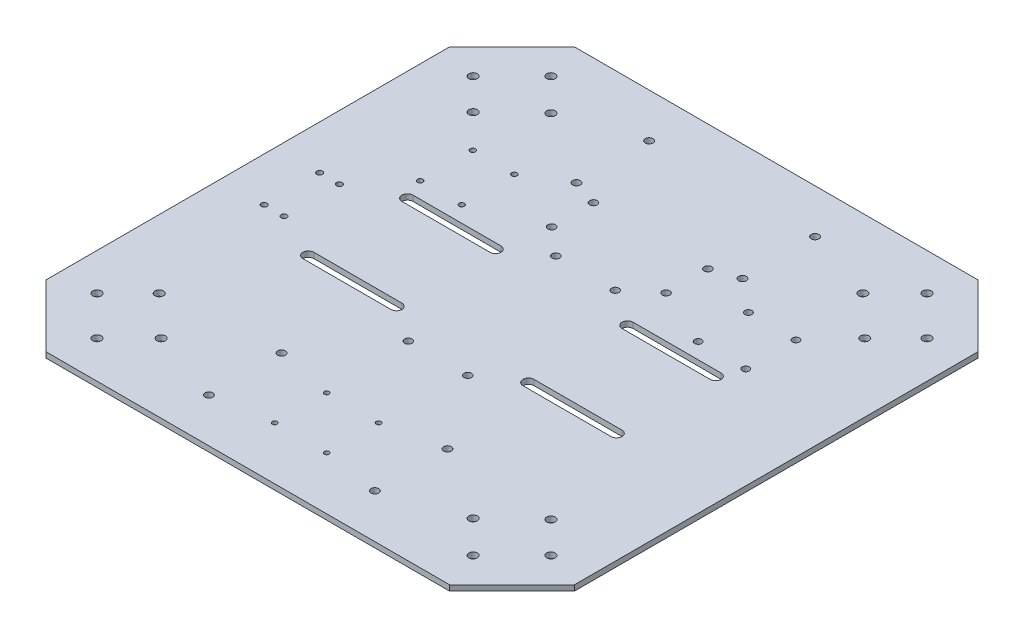
from build123d import *

# Parameters (mm, degrees)
BOSS_EXTRUDE1_DEPTH = 3.175
SKETCH2_R           = 2.4638
CUT_EXTRUDE1_DEPTH  = 6.35
SKETCH3_R           = 2.159
CUT_EXTRUDE2_DEPTH  = 6.35
SKETCH4_R           = 2.2225
CUT_EXTRUDE3_DEPTH  = 351.937720963
SKETCH5_R           = 1.651
CUT_EXTRUDE4_DEPTH  = 351.937720963
SKETCH6_R           = 2.032
SKETCH6_R_2         = 2.159
SKETCH6_R_3         = 1.397
SKETCH6_R_4         = 1.5499969
CUT_EXTRUDE5_DEPTH  = 351.937720963


with BuildPart() as part:
    # Sketch1 → Boss-Extrude1 (new body)
    with BuildSketch(Plane(origin=(0, 0, 0), x_dir=(1, 0, 0), z_dir=(0, 1, 0))):
        Polygon((-25.845025354, 51.656360067), (-61.766049839, 15.735335583), (-61.766049839, -217.222615449), (-25.845025354, -253.143639933), (207.112925677, -253.143639933), (243.033950161, -217.222615449), (243.033950161, 15.735335583), (207.112925677, 51.656360067), align=None)
        with BuildLine():
            ThreePointArc((52.533950161, -126.143639933), (55.708950161, -129.318639933), (52.533950161, -132.493639933))
            Line((52.533950161, -132.493639933), (1.733950161, -132.493639933))
            ThreePointArc((1.733950161, -132.493639933), (-1.441049839, -129.318639933), (1.733950161, -126.143639933))
            Line((1.733950161, -126.143639933), (52.533950161, -126.143639933))
        make_face(mode=Mode.SUBTRACT)
        with BuildLine():
            Line((179.533950161, -132.493639933), (128.733950161, -132.493639933))
            ThreePointArc((128.733950161, -132.493639933), (125.558950161, -129.318639933), (128.733950161, -126.143639933))
            Line((128.733950161, -126.143639933), (179.533950161, -126.143639933))
            ThreePointArc((179.533950161, -126.143639933), (182.708950161, -129.318639933), (179.533950161, -132.493639933))
        make_face(mode=Mode.SUBTRACT)
        with BuildLine():
            Line((1.733950161, -68.993639933), (52.533950161, -68.993639933))
            ThreePointArc((52.533950161, -68.993639933), (55.708950161, -72.168639933), (52.533950161, -75.343639933))
            Line((52.533950161, -75.343639933), (1.733950161, -75.343639933))
            ThreePointArc((1.733950161, -75.343639933), (-1.441049839, -72.168639933), (1.733950161, -68.993639933))
        make_face(mode=Mode.SUBTRACT)
        with BuildLine():
            ThreePointArc((128.733950161, -75.343639933), (125.558950161, -72.168639933), (128.733950161, -68.993639933))
            Line((128.733950161, -68.993639933), (179.533950161, -68.993639933))
            ThreePointArc((179.533950161, -68.993639933), (182.708950161, -72.168639933), (179.533950161, -75.343639933))
            Line((179.533950161, -75.343639933), (128.733950161, -75.343639933))
        make_face(mode=Mode.SUBTRACT)
    extrude(amount=BOSS_EXTRUDE1_DEPTH)

    # Sketch2 → Cut-Extrude1 (cut)
    with BuildSketch(Plane(origin=(0, 3.175, 0), x_dir=(1, 0, 0), z_dir=(0, 1, 0))):
        with Locations(Location((-17.872380726, 30.213331256, 0), (0, 0, 270))):
            Circle(SKETCH2_R)
        with Locations(Location((0.640891541, 11.70005899, 0), (0, 0, 270))):
            Circle(SKETCH2_R)
        with Locations(Location((-22.362508786, -10.197821288, 0), (0, 0, 270))):
            Circle(SKETCH2_R)
        with Locations(Location((-40.323021028, 7.762690954, 0), (0, 0, 270))):
            Circle(SKETCH2_R)
        with Locations(Location((203.630409109, -10.197821288, 0), (0, 0, 270))):
            Circle(SKETCH2_R)
        with Locations(Location((221.590921351, 7.762690954, 0), (0, 0, 270))):
            Circle(SKETCH2_R)
        with Locations(Location((180.627008782, 11.70005899, 0), (0, 0, 270))):
            Circle(SKETCH2_R)
        with Locations(Location((199.140281048, 30.213331256, 0), (0, 0, 270))):
            Circle(SKETCH2_R)
        with Locations(Location((-22.362508786, -191.289458578, 0), (0, 0, 270))):
            Circle(SKETCH2_R)
        with Locations(Location((-40.323021028, -209.24997082, 0), (0, 0, 270))):
            Circle(SKETCH2_R)
        with Locations(Location((-17.872380726, -231.700611123, 0), (0, 0, 270))):
            Circle(SKETCH2_R)
        with Locations(Location((0.640891541, -213.187338857, 0), (0, 0, 270))):
            Circle(SKETCH2_R)
        with Locations(Location((221.590921351, -209.24997082, 0), (0, 0, 270))):
            Circle(SKETCH2_R)
        with Locations(Location((199.140281048, -231.700611123, 0), (0, 0, 270))):
            Circle(SKETCH2_R)
        with Locations(Location((180.627008782, -213.187338857, 0), (0, 0, 270))):
            Circle(SKETCH2_R)
        with Locations(Location((203.630409109, -191.289458578, 0), (0, 0, 270))):
            Circle(SKETCH2_R)
    extrude(amount=-CUT_EXTRUDE1_DEPTH, mode=Mode.SUBTRACT)

    # Sketch3 → Cut-Extrude2 (cut)
    with BuildSketch(Plane(origin=(0, 3.175, 0), x_dir=(1, 0, 0), z_dir=(0, 1, 0))):
        with Locations(Location((73.361950161, -58.198639933, 0), (0, 0, 270))):
            Circle(SKETCH3_R)
        with Locations(Location((107.651950161, -58.198639933, 0), (0, 0, 270))):
            Circle(SKETCH3_R)
        with Locations(Location((73.361950161, -143.288639933, 0), (0, 0, 270))):
            Circle(SKETCH3_R)
        with Locations(Location((107.651950161, -143.288639933, 0), (0, 0, 270))):
            Circle(SKETCH3_R)
    extrude(amount=-CUT_EXTRUDE2_DEPTH, mode=Mode.SUBTRACT)

    # Sketch4 → Cut-Extrude3 (cut, through all)
    with BuildSketch(Plane(origin=(0, 3.175, 0), x_dir=(1, 0, 0), z_dir=(0, 1, 0))):
        with Locations(Location((42.754950161, 26.256360067, 0), (0, 0, 270))):
            Circle(SKETCH4_R)
        with Locations(Location((138.512950161, 26.256360067, 0), (0, 0, 270))):
            Circle(SKETCH4_R)
        with Locations(Location((42.754950161, -15.653639933, 0), (0, 0, 270))):
            Circle(SKETCH4_R)
        with Locations(Location((138.512950161, -15.653639933, 0), (0, 0, 270))):
            Circle(SKETCH4_R)
        with Locations(Location((138.512950161, -185.833639933, 0), (0, 0, 90))):
            Circle(SKETCH4_R)
        with Locations(Location((42.754950161, -185.833639933, 0), (0, 0, 90))):
            Circle(SKETCH4_R)
        with Locations(Location((138.512950161, -227.743639933, 0), (0, 0, 90))):
            Circle(SKETCH4_R)
        with Locations(Location((42.754950161, -227.743639933, 0), (0, 0, 90))):
            Circle(SKETCH4_R)
    extrude(amount=-CUT_EXTRUDE3_DEPTH, mode=Mode.SUBTRACT)

    # Sketch5 → Cut-Extrude4 (cut, through all)
    with BuildSketch(Plane(origin=(0, 3.175, 0), x_dir=(1, 0, 0), z_dir=(0, 1, 0))):
        with Locations(Location((-36.366049839, -84.741639933, 0), (0, 0, 270))):
            Circle(SKETCH5_R)
        with Locations(Location((-24.936049839, -84.741639933, 0), (0, 0, 270))):
            Circle(SKETCH5_R)
        with Locations(Location((-24.936049839, -116.745639933, 0), (0, 0, 90))):
            Circle(SKETCH5_R)
        with Locations(Location((-36.366049839, -116.745639933, 0), (0, 0, 90))):
            Circle(SKETCH5_R)
    extrude(amount=-CUT_EXTRUDE4_DEPTH, mode=Mode.SUBTRACT)

    # Sketch6 → Cut-Extrude5 (cut, through all)
    with BuildSketch(Plane(origin=(0, 3.175, 0), x_dir=(1, 0, 0), z_dir=(0, 1, 0))):
        with Locations(Location((157.181950161, -30.893639933, 0), (0, 0, 270))):
            Circle(SKETCH6_R)
        with Locations(Location((157.181950161, -59.849639933, 0), (0, 0, 270))):
            Circle(SKETCH6_R)
        with Locations(Location((184.613950161, -59.849639933, 0), (0, 0, 270))):
            Circle(SKETCH6_R)
        with Locations(Location((184.613950161, -30.893639933, 0), (0, 0, 270))):
            Circle(SKETCH6_R)
        with Locations(Location((57.613950161, -20.733639933, 0), (0, 0, 270))):
            Circle(SKETCH6_R_2)
        with Locations(Location((57.613950161, -44.863639933, 0), (0, 0, 270))):
            Circle(SKETCH6_R_2)
        with Locations(Location((123.653950161, -44.863639933, 0), (0, 0, 90))):
            Circle(SKETCH6_R_2)
        with Locations(Location((123.653950161, -20.733639933, 0), (0, 0, 90))):
            Circle(SKETCH6_R_2)
        with Locations(Location((75.647950161, -192.691639933, 0), (0, 0, 270))):
            Circle(SKETCH6_R_3)
        with Locations(Location((75.647950161, -222.663639933, 0), (0, 0, 270))):
            Circle(SKETCH6_R_3)
        with Locations(Location((105.619950161, -222.663639933, 0), (0, 0, 90))):
            Circle(SKETCH6_R_3)
        with Locations(Location((105.619950161, -192.691639933, 0), (0, 0, 90))):
            Circle(SKETCH6_R_3)
        with Locations(Location((-3.388950787, -29.369639933, 0), (0, 0, 270))):
            Circle(SKETCH6_R_4)
        with Locations(Location((-3.346049839, -59.769599662, 0), (0, 0, 270))):
            Circle(SKETCH6_R_4)
        with Locations(Location((20.611052013, -29.369639933, 0), (0, 0, 270))):
            Circle(SKETCH6_R_4)
        with Locations(Location((20.611052013, -59.769599662, 0), (0, 0, 270))):
            Circle(SKETCH6_R_4)
    extrude(amount=-CUT_EXTRUDE5_DEPTH, mode=Mode.SUBTRACT)


solid = part.part
